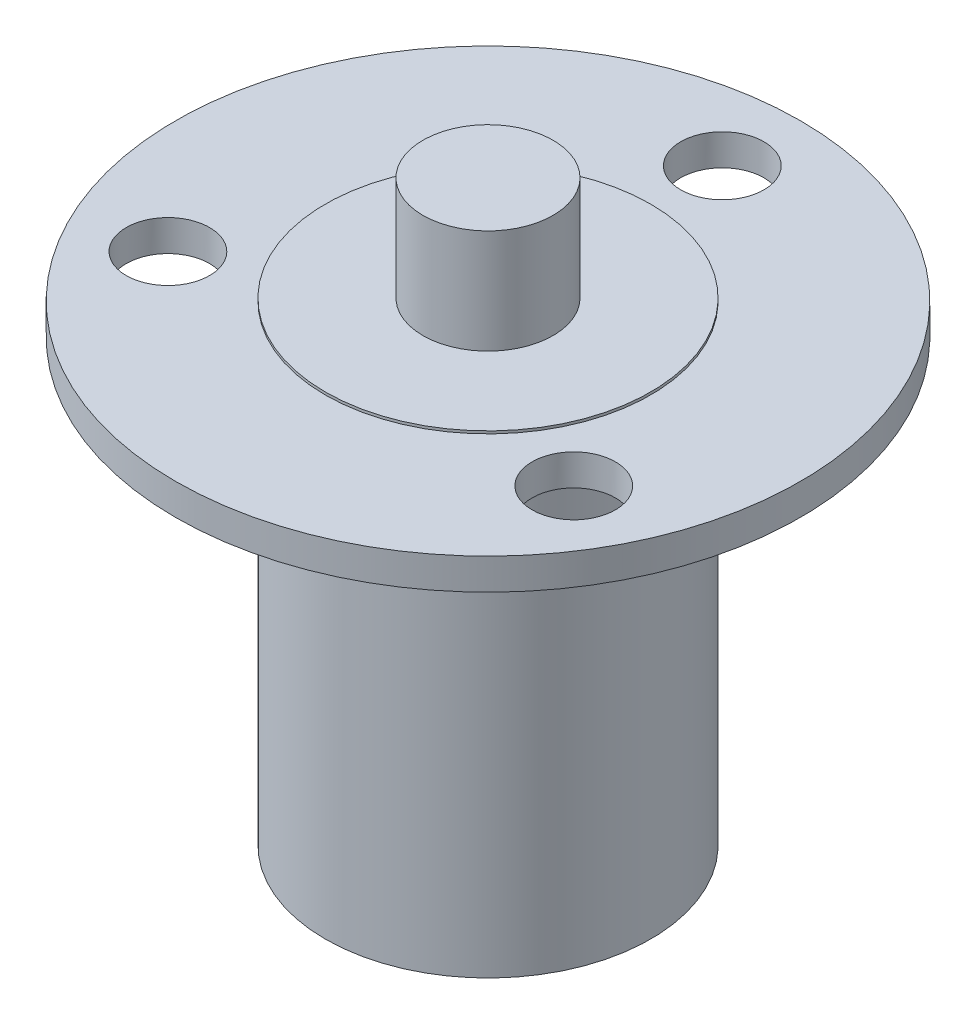
from build123d import *

# Parameters (mm, degrees)
SKETCH_1_W                  = 12
SKETCH_1_H                  = 1.2
SKETCH_2_R                  = 6.25
EXTRUDE_1_DEPTH             = 0.1
SKETCH_3_R                  = 2.5
EXTRUDE_2_DEPTH             = 4
EXTRUDE_START               = 16.9
SKETCH_5_R                  = 6.25
EXTRUDE_4_DEPTH             = 16.9
HOLE_WIZARD_3_2_3_2_1_D     = 3.2
HOLE_WIZARD_3_2_3_2_1_DEPTH = 18.1


with BuildPart() as part:
    # 草图1 → 旋转1 (revolve)
    with BuildSketch(Plane.XY, mode=Mode.PRIVATE) as revolve_1_sk:
        with Locations((6, 17.5)):
            Rectangle(SKETCH_1_W, SKETCH_1_H)
    revolve(revolve_1_sk.sketch.rotate(Axis((0, 18.1, 0), (0, -1, 0)), 270), axis=Axis((0, 18.1, 0), (0, -1, 0)))

    # 草图2 → 凸台-拉伸1 (add)
    with BuildSketch(Plane(origin=(0, 18.1, 0), x_dir=(-1, 0, 0), z_dir=(0, 1, 0))):
        with Locations(Location((0, 0, 0), (0, 0, 90))):
            Circle(SKETCH_2_R)
    extrude(amount=EXTRUDE_1_DEPTH)

    # 草图3 → 凸台-拉伸2 (add)
    with BuildSketch(Plane(origin=(0, 18.2, 0), x_dir=(-1, 0, 0), z_dir=(0, 1, 0))):
        with Locations(Location((0, 0, 0), (0, 0, 90))):
            Circle(SKETCH_3_R)
    extrude(amount=EXTRUDE_2_DEPTH)

    # 草图5 → 凸台-拉伸4 (add)
    with BuildSketch(Plane.XZ.offset(-16.9).offset(EXTRUDE_START)):
        with Locations(Location((0, 0, 0), (0, 0, 90))):
            Circle(SKETCH_5_R)
    extrude(amount=-EXTRUDE_4_DEPTH)

    # Ø3.2 (3.2) 直径孔1
    with Locations(Plane(origin=(0, 18.1, 0), x_dir=(1, 0, 0), z_dir=(0, 1, 0))):
        with Locations((-7.794228634, -4.5), (7.794228634, -4.5), (0, 9)):
            Hole(HOLE_WIZARD_3_2_3_2_1_D / 2, depth=HOLE_WIZARD_3_2_3_2_1_DEPTH)


solid = part.part
